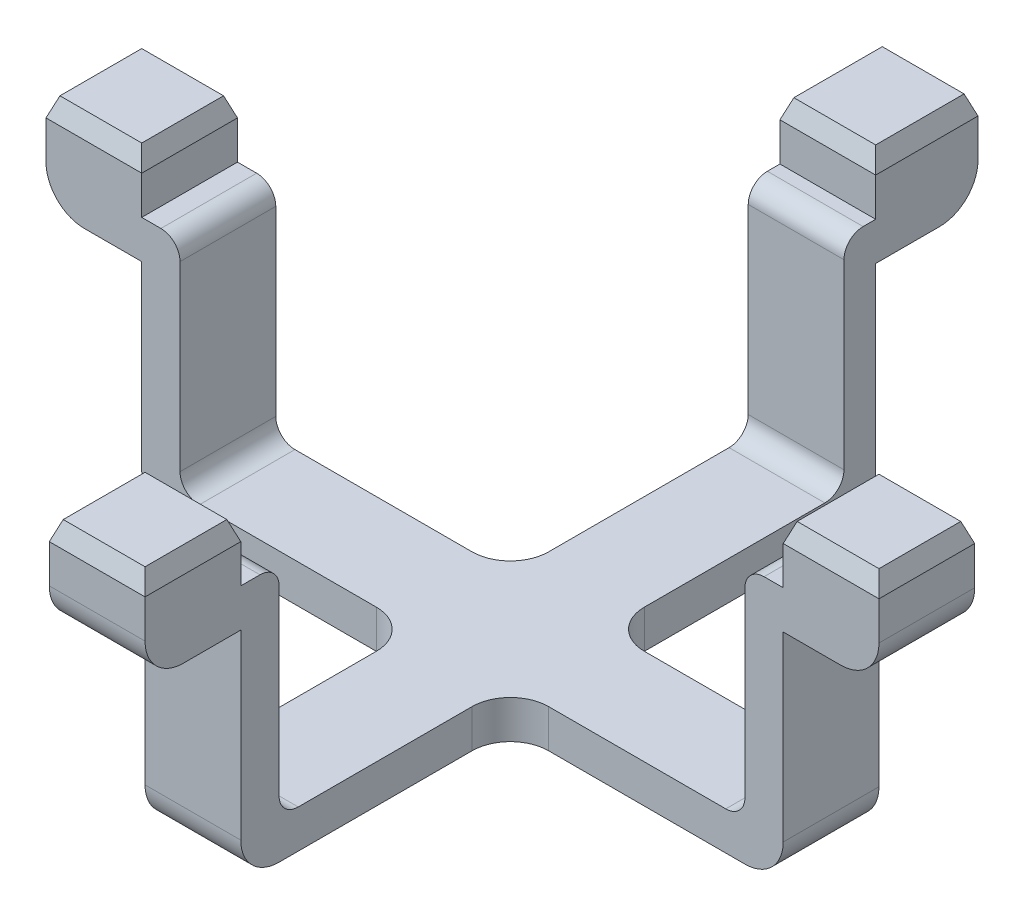
from build123d import *
from OCP.BRepFilletAPI import BRepFilletAPI_MakeChamfer

# Parameters (mm, degrees)
BOSS_EXTRUDE1_DEPTH      = 5
BOSS_EXTRUDE2_DEPTH      = 2.5
BOSS_EXTRUDE2_DEPTH_BACK = 2.5
SKETCH6_W                = 5
SKETCH6_H                = 5
SKETCH6_H_2              = 5.343869798
BOSS_EXTRUDE3_DEPTH      = 3
FILLET1_R                = 1
FILLET2_R                = 2
CHAMFER1_SIZE            = 1
CHAMFER1_SIZE2           = 0.363970234
FILLET3_R                = 1


with BuildPart() as part:
    # Sketch1 → Boss-Extrude1 (new body)
    with BuildSketch(Plane.XY):
        Polygon((16.75, 0), (-16.75, 0), (-16.75, 11.5), (-21.75, 11.5), (-21.75, 13.5), (-14.75, 13.5), (-14.75, 2), (14.75, 2), (14.75, 13.5), (21.75, 13.5), (21.75, 11.5), (16.75, 11.5), align=None)
    extrude(amount=-BOSS_EXTRUDE1_DEPTH)

    # Sketch5 → Boss-Extrude2 (add, two sides: drawn at the far end of the back side and taken through both)
    with BuildSketch(Plane(origin=(0, 0, 0), x_dir=(0, 0, -1), z_dir=(1, 0, 0)).offset(-BOSS_EXTRUDE2_DEPTH_BACK)):
        Polygon((19.078065101, 0), (-14.078065101, 0), (-14.078065101, 11.5), (-19.078065101, 11.5), (-19.078065101, 13.5), (-12.078065101, 13.5), (-12.078065101, 2), (17.421934899, 2), (17.421934899, 13.5), (24.421934899, 13.5), (24.421934899, 11.5), (19.078065101, 11.5), align=None)
    extrude(amount=BOSS_EXTRUDE2_DEPTH + BOSS_EXTRUDE2_DEPTH_BACK)

    # Sketch6 → Boss-Extrude3 (add)
    with BuildSketch(Plane(origin=(0, 13.5, 0), x_dir=(1, 0, 0), z_dir=(0, 1, 0))):
        with Locations((19.25, 2.5)):
            Rectangle(SKETCH6_W, SKETCH6_H)
        with Locations((0, -16.578065101)):
            Rectangle(SKETCH6_W, SKETCH6_H)
        with Locations((-19.25, 2.5)):
            Rectangle(SKETCH6_W, SKETCH6_H)
        with Locations((0, 21.75)):
            Rectangle(SKETCH6_W, SKETCH6_H_2)
    extrude(amount=BOSS_EXTRUDE3_DEPTH)

    # Fillet1
    fillet1_edges = [part.edges().sort_by_distance(p)[0] for p in [
        (-14.75, 2, -2.5),
        (14.75, 2, -2.5),
        (0, 2, 12.078065101),
        (0, 2, -17.421934899),
    ]]
    fillet(fillet1_edges, radius=FILLET1_R)

    # Fillet2
    fillet2_edges = [part.edges().sort_by_distance(p)[0] for p in [
        (-21.75, 11.5, -2.5),
        (21.75, 11.5, -2.5),
        (16.75, 0, -2.5),
        (-16.75, 0, -2.5),
        (2.5, 1, 0),
        (-2.5, 1, 0),
        (0, 0, -19.078065101),
        (-2.5, 1, -5),
        (2.5, 1, -5),
        (0, 0, 14.078065101),
        (0, 11.5, 19.078065101),
        (0, 11.5, -24.421934899),
    ]]
    fillet(fillet2_edges, radius=FILLET2_R)

    # Chamfer1: one chamfer whose edges measure the first distance from different faces: ONE call of the kernel's chamfer builder (chamfer() names one face for all edges)
    chamfer1_edges_1 = [part.edges().sort_by_distance(p)[0] for p in [
        (-16.75, 16.5, -2.5),
    ]]
    chamfer1_side_1 = [part.faces().sort_by_distance(p)[0] for p in [
        (-16.75, 15, -2.5),
    ]]
    chamfer1_edges_2 = [part.edges().sort_by_distance(p)[0] for p in [
        (-19.25, 16.5, -5),
    ]]
    chamfer1_side_2 = [part.faces().sort_by_distance(p)[0] for p in [
        (-15.136362203, 7.64232962, -5),
    ]]
    chamfer1_edges_3 = [part.edges().sort_by_distance(p)[0] for p in [
        (-21.75, 16.5, -2.5),
    ]]
    chamfer1_side_3 = [part.faces().sort_by_distance(p)[0] for p in [
        (-21.75, 15, -2.5),
    ]]
    chamfer1_edges_4 = [part.edges().sort_by_distance(p)[0] for p in [
        (-19.25, 16.5, 0),
    ]]
    chamfer1_side_4 = [part.faces().sort_by_distance(p)[0] for p in [
        (-15.136362203, 7.64232962, 0),
    ]]
    chamfer1_edges_5 = [part.edges().sort_by_distance(p)[0] for p in [
        (-2.5, 16.5, -21.75),
    ]]
    chamfer1_side_5 = [part.faces().sort_by_distance(p)[0] for p in [
        (-2.5, 7.829257404, -17.697130979),
    ]]
    chamfer1_edges_6 = [part.edges().sort_by_distance(p)[0] for p in [
        (0, 16.5, -19.078065101),
    ]]
    chamfer1_side_6 = [part.faces().sort_by_distance(p)[0] for p in [
        (0, 15, -19.078065101),
    ]]
    chamfer1_edges_7 = [part.edges().sort_by_distance(p)[0] for p in [
        (2.5, 16.5, -21.75),
    ]]
    chamfer1_side_7 = [part.faces().sort_by_distance(p)[0] for p in [
        (2.5, 7.829257404, -17.697130979),
    ]]
    chamfer1_edges_8 = [part.edges().sort_by_distance(p)[0] for p in [
        (0, 16.5, -24.421934899),
    ]]
    chamfer1_side_8 = [part.faces().sort_by_distance(p)[0] for p in [
        (0, 15, -24.421934899),
    ]]
    chamfer1_edges_9 = [part.edges().sort_by_distance(p)[0] for p in [
        (21.75, 16.5, -2.5),
    ]]
    chamfer1_side_9 = [part.faces().sort_by_distance(p)[0] for p in [
        (21.75, 15, -2.5),
    ]]
    chamfer1_edges_10 = [part.edges().sort_by_distance(p)[0] for p in [
        (19.25, 16.5, -5),
    ]]
    chamfer1_side_10 = [part.faces().sort_by_distance(p)[0] for p in [
        (15.136362203, 7.64232962, -5),
    ]]
    chamfer1_edges_11 = [part.edges().sort_by_distance(p)[0] for p in [
        (16.75, 16.5, -2.5),
    ]]
    chamfer1_side_11 = [part.faces().sort_by_distance(p)[0] for p in [
        (16.75, 15, -2.5),
    ]]
    chamfer1_edges_12 = [part.edges().sort_by_distance(p)[0] for p in [
        (19.25, 16.5, 0),
    ]]
    chamfer1_side_12 = [part.faces().sort_by_distance(p)[0] for p in [
        (15.136362203, 7.64232962, 0),
    ]]
    chamfer1_edges_13 = [part.edges().sort_by_distance(p)[0] for p in [
        (-2.5, 16.5, 16.578065101),
    ]]
    chamfer1_side_13 = [part.faces().sort_by_distance(p)[0] for p in [
        (-2.5, 7.674657573, 12.515775654),
    ]]
    chamfer1_edges_14 = [part.edges().sort_by_distance(p)[0] for p in [
        (0, 16.5, 19.078065101),
    ]]
    chamfer1_side_14 = [part.faces().sort_by_distance(p)[0] for p in [
        (0, 15, 19.078065101),
    ]]
    chamfer1_edges_15 = [part.edges().sort_by_distance(p)[0] for p in [
        (2.5, 16.5, 16.578065101),
    ]]
    chamfer1_side_15 = [part.faces().sort_by_distance(p)[0] for p in [
        (2.5, 7.674657573, 12.515775654),
    ]]
    chamfer1_edges_16 = [part.edges().sort_by_distance(p)[0] for p in [
        (0, 16.5, 14.078065101),
    ]]
    chamfer1_side_16 = [part.faces().sort_by_distance(p)[0] for p in [
        (0, 15, 14.078065101),
    ]]
    chamfer1 = BRepFilletAPI_MakeChamfer(part.part.solid().wrapped)
    for e in chamfer1_edges_1:
        chamfer1.Add(CHAMFER1_SIZE, CHAMFER1_SIZE2, e.wrapped, chamfer1_side_1[0].wrapped)  # the first distance lies on this face
    for e in chamfer1_edges_2:
        chamfer1.Add(CHAMFER1_SIZE, CHAMFER1_SIZE2, e.wrapped, chamfer1_side_2[0].wrapped)  # the first distance lies on this face
    for e in chamfer1_edges_3:
        chamfer1.Add(CHAMFER1_SIZE, CHAMFER1_SIZE2, e.wrapped, chamfer1_side_3[0].wrapped)  # the first distance lies on this face
    for e in chamfer1_edges_4:
        chamfer1.Add(CHAMFER1_SIZE, CHAMFER1_SIZE2, e.wrapped, chamfer1_side_4[0].wrapped)  # the first distance lies on this face
    for e in chamfer1_edges_5:
        chamfer1.Add(CHAMFER1_SIZE, CHAMFER1_SIZE2, e.wrapped, chamfer1_side_5[0].wrapped)  # the first distance lies on this face
    for e in chamfer1_edges_6:
        chamfer1.Add(CHAMFER1_SIZE, CHAMFER1_SIZE2, e.wrapped, chamfer1_side_6[0].wrapped)  # the first distance lies on this face
    for e in chamfer1_edges_7:
        chamfer1.Add(CHAMFER1_SIZE, CHAMFER1_SIZE2, e.wrapped, chamfer1_side_7[0].wrapped)  # the first distance lies on this face
    for e in chamfer1_edges_8:
        chamfer1.Add(CHAMFER1_SIZE, CHAMFER1_SIZE2, e.wrapped, chamfer1_side_8[0].wrapped)  # the first distance lies on this face
    for e in chamfer1_edges_9:
        chamfer1.Add(CHAMFER1_SIZE, CHAMFER1_SIZE2, e.wrapped, chamfer1_side_9[0].wrapped)  # the first distance lies on this face
    for e in chamfer1_edges_10:
        chamfer1.Add(CHAMFER1_SIZE, CHAMFER1_SIZE2, e.wrapped, chamfer1_side_10[0].wrapped)  # the first distance lies on this face
    for e in chamfer1_edges_11:
        chamfer1.Add(CHAMFER1_SIZE, CHAMFER1_SIZE2, e.wrapped, chamfer1_side_11[0].wrapped)  # the first distance lies on this face
    for e in chamfer1_edges_12:
        chamfer1.Add(CHAMFER1_SIZE, CHAMFER1_SIZE2, e.wrapped, chamfer1_side_12[0].wrapped)  # the first distance lies on this face
    for e in chamfer1_edges_13:
        chamfer1.Add(CHAMFER1_SIZE, CHAMFER1_SIZE2, e.wrapped, chamfer1_side_13[0].wrapped)  # the first distance lies on this face
    for e in chamfer1_edges_14:
        chamfer1.Add(CHAMFER1_SIZE, CHAMFER1_SIZE2, e.wrapped, chamfer1_side_14[0].wrapped)  # the first distance lies on this face
    for e in chamfer1_edges_15:
        chamfer1.Add(CHAMFER1_SIZE, CHAMFER1_SIZE2, e.wrapped, chamfer1_side_15[0].wrapped)  # the first distance lies on this face
    for e in chamfer1_edges_16:
        chamfer1.Add(CHAMFER1_SIZE, CHAMFER1_SIZE2, e.wrapped, chamfer1_side_16[0].wrapped)  # the first distance lies on this face
    add(Compound.cast(chamfer1.Shape()), mode=Mode.REPLACE)

    # Fillet3
    fillet3_edges = [part.edges().sort_by_distance(p)[0] for p in [
        (-14.75, 13.5, -2.5),
        (14.75, 13.5, -2.5),
        (0, 13.5, 12.078065101),
        (0, 13.5, -17.421934899),
    ]]
    fillet(fillet3_edges, radius=FILLET3_R)


solid = part.part
